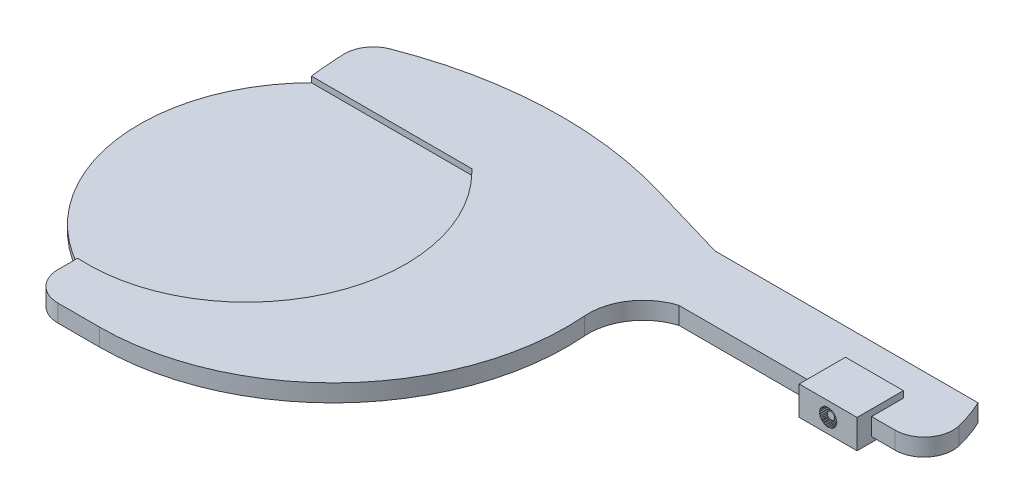
from build123d import *

# Parameters (mm, degrees)
SKETCH2_R                = 30
BOSS_EXTRUDE1_DEPTH      = 1
BOSS_EXTRUDE2_DEPTH      = 1
BOSS_EXTRUDE2_DEPTH_BACK = 2
SCALE1_SCALE             = 2
BOSS_EXTRUDE3_DEPTH      = 5
BOSS_EXTRUDE3_DEPTH_BACK = 11
SKETCH5_W                = 20
SKETCH5_H                = 10
FILLET1_R                = 10
FILLET2_R                = 10
FILLET3_R                = 10
CUT_EXTRUDE3_DEPTH       = 3
SKETCH13_R               = 1.25
BOSS_EXTRUDE4_DEPTH      = 2
SCALE2_SCALE             = 0.8


with BuildPart() as part:
    # Sketch2 → Boss-Extrude1 (new body)
    with BuildSketch(Plane(origin=(0, 0, 0), x_dir=(1, 0, 0), z_dir=(0, 1, 0))):
        with Locations(Location((0, 0, 0), (0, 0, 270))):
            Circle(SKETCH2_R)
    extrude(amount=BOSS_EXTRUDE1_DEPTH)

    # Sketch3 → Boss-Extrude2 (add, two sides: drawn at the far end of the back side and taken through both)
    with BuildSketch(Plane(origin=(0, 1, 0), x_dir=(1, 0, 0), z_dir=(0, 1, 0)).offset(-BOSS_EXTRUDE2_DEPTH_BACK)):
        with BuildLine():
            Line((-14.290451106, -26.37769905), (-14.290451106, -34.782711282))
            Line((-14.290451106, -34.782711282), (-2.11058873, -34.782711282))
            ThreePointArc((-2.11058873, -34.782711282), (27.5349766, -21.80785282), (38.117480018, 8.773466924))
            ThreePointArc((38.117480018, 8.773466924), (39.698443789, 14.79025178), (44.684067377, 18.511098982))
            Line((44.684067377, 18.511098982), (87.64168842, 18.511098982))
            ThreePointArc((87.64168842, 18.511098982), (86.998038921, 24.281089627), (85.098734122, 29.767410617))
            Line((85.098734122, 29.767410617), (39.674176802, 29.767410617))
            Line((39.674176802, 29.767410617), (25.714146622, 33.856712387))
            ThreePointArc((25.714146622, 33.856712387), (1.610609717, 36.463459714), (-21.899290339, 30.542292401))
            ThreePointArc((-21.899290339, 30.542292401), (-21.763636639, 25.798277328), (-21.355544159, 21.069901131))
            Line((-21.355544159, 21.069901131), (6.360164673, 21.069901131))
            Line((6.360164673, 21.069901131), (6.867267346, 20.563219729))
            ThreePointArc((6.867267346, 20.563219729), (12.505714755, -10.216879454), (-14.290451106, -26.37769905))
        make_face()
    extrude(amount=BOSS_EXTRUDE2_DEPTH + BOSS_EXTRUDE2_DEPTH_BACK)


with BuildPart() as part_1:
    # Scale1: scaled about (18.795730072, 0.5, -7.565232671)
    add(part.part.scale(SCALE1_SCALE).moved(Location((-18.795730072, -0.5, 7.565232671))))

    # Sketch5 → Boss-Extrude3 (add, two sides: drawn at the far end of the back side and taken through both)
    with BuildSketch(Plane.XY.offset(-29.456965293).offset(-BOSS_EXTRUDE3_DEPTH_BACK)):
        with Locations((127.136416626, 0.749159319)):
            Rectangle(SKETCH5_W, SKETCH5_H)
    extrude(amount=BOSS_EXTRUDE3_DEPTH + BOSS_EXTRUDE3_DEPTH_BACK)

    # Fillet1
    fillet1_edges = [part_1.edges().sort_by_distance(p)[0] for p in [
        (-47.376632285, 0.5, 77.130655235),
    ]]
    fillet(fillet1_edges, radius=FILLET1_R)

    # Fillet2
    fillet2_edges = [part_1.edges().sort_by_distance(p)[0] for p in [
        (-62.59431075, 0.5, -53.519352131),
    ]]
    fillet(fillet2_edges, radius=FILLET2_R)

    # Fillet3
    fillet3_edges = [part_1.edges().sort_by_distance(p)[0] for p in [
        (156.487646768, 0.5, -29.456965293),
    ]]
    fillet(fillet3_edges, radius=FILLET3_R)

    # Sketch12 → Cut-Extrude3 (cut)
    with BuildSketch(Plane.XY.offset(-24.456965293)):
        Polygon((124.436416626, 0.749159319), (124.145484747, 0.961193849), (124.186719528, 1.287600755), (124.521242091, 1.420622015), (124.292181215, 1.698346906), (124.413294627, 2.004244466), (124.770388589, 2.049894239), (124.617591455, 2.375859016), (124.810973495, 2.64202656), (125.168201332, 2.597436505), (125.101268743, 2.951159601), (125.354768508, 3.160872845), (125.689684279, 3.028844718), (125.712821858, 3.38810041), (126.010511024, 3.528182299), (126.302070741, 3.317011913), (126.413824668, 3.659226845), (126.736998331, 3.720875519), (126.966882223, 3.443831486), (127.160230587, 3.747503035), (127.488582557, 3.72684488), (127.642346175, 3.401334896), (127.905140188, 3.647382262), (128.218038903, 3.545715307), (128.286020713, 3.192192361), (128.601748061, 3.365155483), (128.879532943, 3.188867836), (128.857461398, 2.829545075), (129.20628377, 2.918556044), (129.431500575, 2.678724506), (129.32076251, 2.3361795), (129.680762114, 2.33564543), (129.839259641, 2.047339499), (129.646813137, 1.743095611), (129.995369874, 1.653050059), (130.07718914, 1.334385057), (129.815126319, 1.08755905), (130.130339086, 0.913659908), (130.130339086, 0.58465873), (129.815126319, 0.410759589), (130.07718914, 0.163933581), (129.995369874, -0.15473142), (129.646813137, -0.244776973), (129.839259641, -0.549020861), (129.680762114, -0.837326791), (129.32076251, -0.837860862), (129.431500575, -1.180405868), (129.20628377, -1.420237405), (128.857461398, -1.331226436), (128.879532943, -1.690549198), (128.601748061, -1.866836845), (128.286020713, -1.693873722), (128.218038903, -2.047396669), (127.905140188, -2.149063624), (127.642346175, -1.903016258), (127.488582557, -2.228526242), (127.136416626, -2.250840681), (126.966882223, -1.945512848), (126.736998331, -2.22255688), (126.379896011, -2.153886764), (126.302070741, -1.818693275), (126.010511024, -2.029863661), (125.712821858, -1.889781772), (125.689684279, -1.53052608), (125.354768508, -1.662554207), (125.101268743, -1.452840963), (125.168201332, -1.099117867), (124.810973495, -1.143707922), (124.617591455, -0.877540378), (124.770388589, -0.551575601), (124.413294627, -0.505925827), (124.292181215, -0.200028268), (124.521242091, 0.077696624), (124.186719528, 0.210717883), (124.145484747, 0.537124789), align=None)
    extrude(amount=-CUT_EXTRUDE3_DEPTH, mode=Mode.SUBTRACT)

    # Sketch13 → Boss-Extrude4 (add)
    with BuildSketch(Plane.XY.offset(-27.456965293)):
        with Locations((127.136416626, 0.749159319)):
            Circle(SKETCH13_R)
    extrude(amount=BOSS_EXTRUDE4_DEPTH)


with BuildPart() as part_2:
    # Scale2: scaled about (21.037420475, 0.509511918, -8.126150546)
    add(part_1.part.scale(SCALE2_SCALE).moved(Location((4.207484095, 0.101902384, -1.625230109))))


solid = part_2.part
